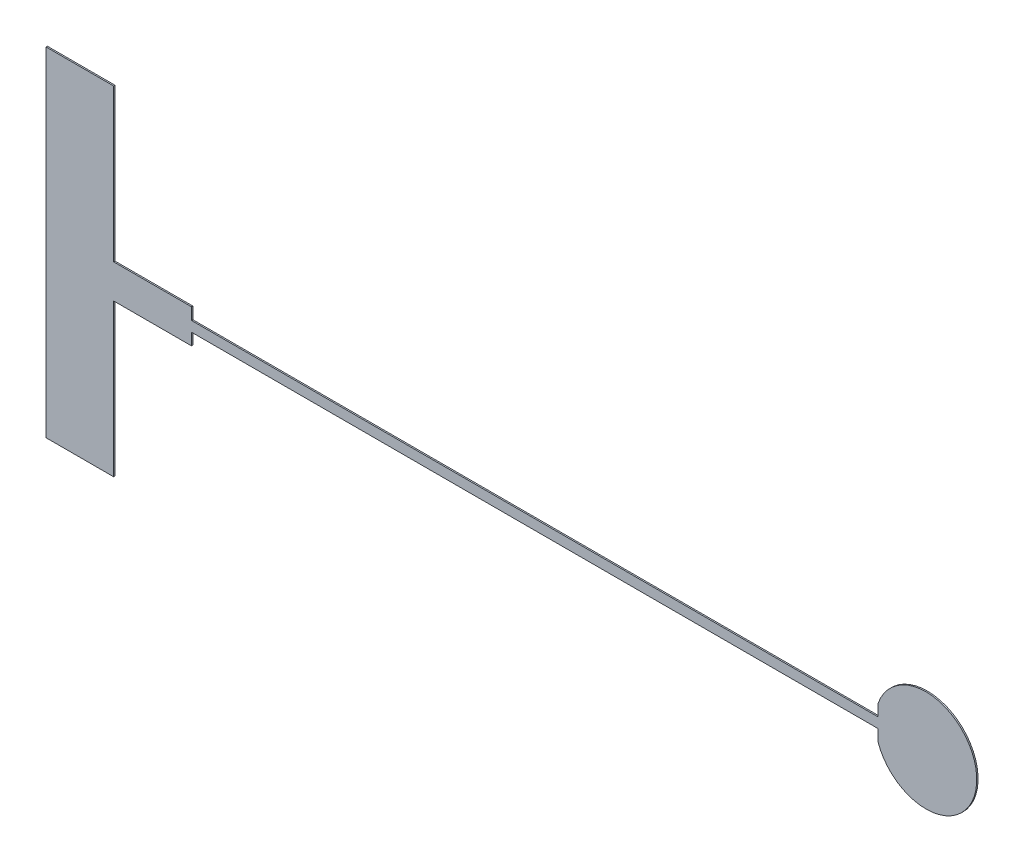
from build123d import *

# Parameters (mm, degrees)
BOSS_EXTRUDE1_DEPTH = 20
SKETCH2_W           = 1000
SKETCH2_H           = 2250
CUT_EXTRUDE1_DEPTH  = 12993.801853334
CUT_EXTRUDE4_DEPTH  = 12993.801853334
SKETCH5_W           = 11500
SKETCH5_H           = 500
BOSS_EXTRUDE2_DEPTH = 20
SKETCH7_W           = 10142.893218813
SKETCH7_H           = 100
CUT_EXTRUDE5_DEPTH  = 12993.801853334
SKETCH8_W           = 10142.893218813
SKETCH8_H           = 75
CUT_EXTRUDE6_DEPTH  = 12993.801853334


with BuildPart() as part:
    # Sketch1 → Boss-Extrude1 (new body)
    with BuildSketch(Plane.XY):
        with BuildLine():
            Line((1000, 250), (5000, 250))
            Line((5000, 250), (5000, 125))
            Line((5000, 125), (9000, 125))
            Line((9000, 125), (9000, 100))
            Line((9000, 100), (11256.696562634, 100))
            ThreePointArc((11256.696562634, 100), (12750, 0), (11256.696562634, -100))
            Line((11256.696562634, -100), (9000, -100))
            Line((9000, -100), (9000, -125))
            Line((9000, -125), (5000, -125))
            Line((5000, -125), (5000, -250))
            Line((5000, -250), (1000, -250))
            Line((1000, -250), (1000, -2500))
            Line((1000, -2500), (-1000, -2500))
            Line((-1000, -2500), (-1000, 2500))
            Line((-1000, 2500), (1000, 2500))
            Line((1000, 2500), (1000, 250))
        make_face()
    extrude(amount=-BOSS_EXTRUDE1_DEPTH)

    # Sketch2 → Cut-Extrude1 (cut, through all)
    with BuildSketch(Plane.XY):
        with Locations((500, 1375)):
            Rectangle(SKETCH2_W, SKETCH2_H)
        with Locations((500, -1375)):
            Rectangle(SKETCH2_W, SKETCH2_H)
    extrude(amount=-CUT_EXTRUDE1_DEPTH, mode=Mode.SUBTRACT)

    # Sketch3 → Cut-Extrude4 (cut, through all)
    with BuildSketch(Plane.XY):
        Polygon((1500, -250), (3250, -250), (5000, -250), (5000, -150), (3250, -150), (3250, -200), (1500, -200), align=None)
    cut_extrude4 = extrude(amount=-CUT_EXTRUDE4_DEPTH, mode=Mode.SUBTRACT)

    # Mirror1: Cut-Extrude4 across plane
    add(cut_extrude4.mirror(Plane.ZX), mode=Mode.SUBTRACT)

    # Sketch5 → Boss-Extrude2 (add)
    with BuildSketch(Plane.XY):
        with Locations((5750, 0)):
            Rectangle(SKETCH5_W, SKETCH5_H)
    extrude(amount=-BOSS_EXTRUDE2_DEPTH)

    # Sketch7 → Cut-Extrude5 (cut, through all)
    with BuildSketch(Plane.XY):
        with Locations((6221.446609407, 200)):
            Rectangle(SKETCH7_W, SKETCH7_H)
    cut_extrude5 = extrude(amount=-CUT_EXTRUDE5_DEPTH, mode=Mode.SUBTRACT)

    # Mirror2: Cut-Extrude5 across plane
    add(cut_extrude5.mirror(Plane.ZX), mode=Mode.SUBTRACT)

    # Sketch8 → Cut-Extrude6 (cut, through all)
    with BuildSketch(Plane.XY):
        with Locations((6221.446609407, 112.5)):
            Rectangle(SKETCH8_W, SKETCH8_H)
    cut_extrude6 = extrude(amount=-CUT_EXTRUDE6_DEPTH, mode=Mode.SUBTRACT)

    # Mirror3: Cut-Extrude6 across plane
    add(cut_extrude6.mirror(Plane.ZX), mode=Mode.SUBTRACT)


solid = part.part
